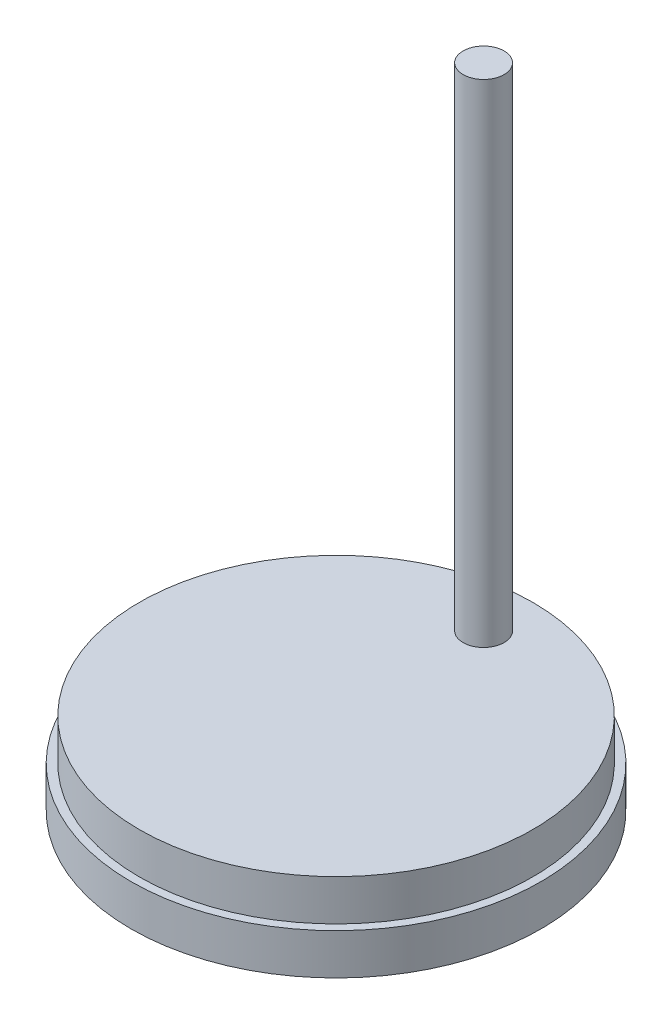
from build123d import *

# Parameters (mm, degrees)
SKETCH1_R           = 50
BOSS_EXTRUDE1_DEPTH = 10
SKETCH2_R           = 48
BOSS_EXTRUDE2_DEPTH = 10
SKETCH3_R           = 5
BOSS_EXTRUDE3_DEPTH = 120


with BuildPart() as part:
    # Sketch1 → Boss-Extrude1 (new body)
    with BuildSketch(Plane(origin=(0, 0, 0), x_dir=(1, 0, 0), z_dir=(0, 1, 0))):
        with Locations(Location((0, 0, 0), (0, 0, 270))):
            Circle(SKETCH1_R)
    extrude(amount=BOSS_EXTRUDE1_DEPTH)

    # Sketch2 → Boss-Extrude2 (add)
    with BuildSketch(Plane(origin=(0, 10, 0), x_dir=(1, 0, 0), z_dir=(0, 1, 0))):
        with Locations(Location((0, 0, 0), (0, 0, 270))):
            Circle(SKETCH2_R)
    extrude(amount=BOSS_EXTRUDE2_DEPTH)

    # Sketch3 → Boss-Extrude3 (add)
    with BuildSketch(Plane(origin=(0, 20, 0), x_dir=(1, 0, 0), z_dir=(0, 1, 0))):
        with Locations(Location((0, 35.989427073, 0), (0, 0, 270))):
            Circle(SKETCH3_R)
    extrude(amount=BOSS_EXTRUDE3_DEPTH)


solid = part.part
